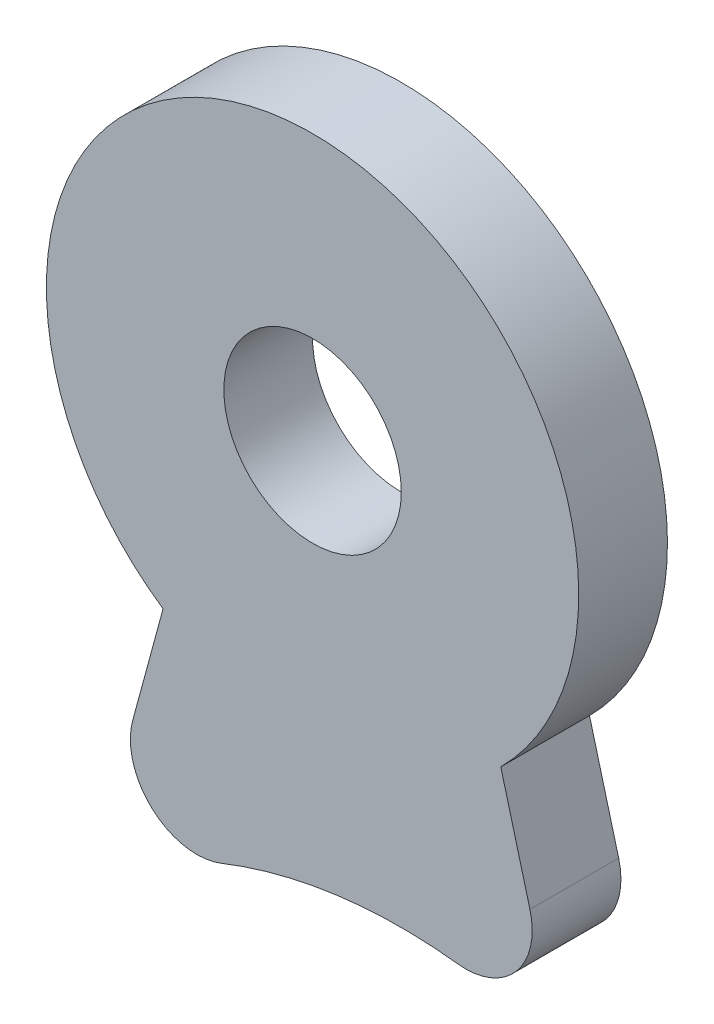
from build123d import *

# Parameters (mm, degrees)
SKETCH1_R           = 6
SKETCH1_R_2         = 2
BOSS_EXTRUDE1_DEPTH = 2
FILLET1_R           = 1.5


with BuildPart() as part:
    # Sketch1 → Boss-Extrude1 (new body)
    # profile 1 of 2: a face of its own
    with BuildSketch(Plane.XY):
        with Locations((-174.416251328, -25.172160385)):
            Circle(SKETCH1_R)
        with Locations((-174.416251328, -25.172160385)):
            Circle(SKETCH1_R_2, mode=Mode.SUBTRACT)
    # profile 2 of 2: a face of its own
    with BuildSketch(Plane.XY):
        with BuildLine():
            ThreePointArc((-170.173610641, -29.414801072), (-173.850108495, -31.145390859), (-177.78627055, -30.13632904))
            Line((-177.78627055, -30.13632904), (-179.432101814, -36.199979912))
            ThreePointArc((-179.432101814, -36.199979912), (-174.407079396, -33.853814689), (-168.876035514, -34.257417374))
            Line((-168.876035514, -34.257417374), (-170.173610641, -29.414801072))
        make_face()
    extrude(amount=BOSS_EXTRUDE1_DEPTH)

    # Fillet1
    fillet1_edges = [part.edges().sort_by_distance(p)[0] for p in [
        (-168.876035514, -34.257417374, 1),
        (-179.432101814, -36.199979912, 1),
    ]]
    fillet(fillet1_edges, radius=FILLET1_R)


solid = part.part
